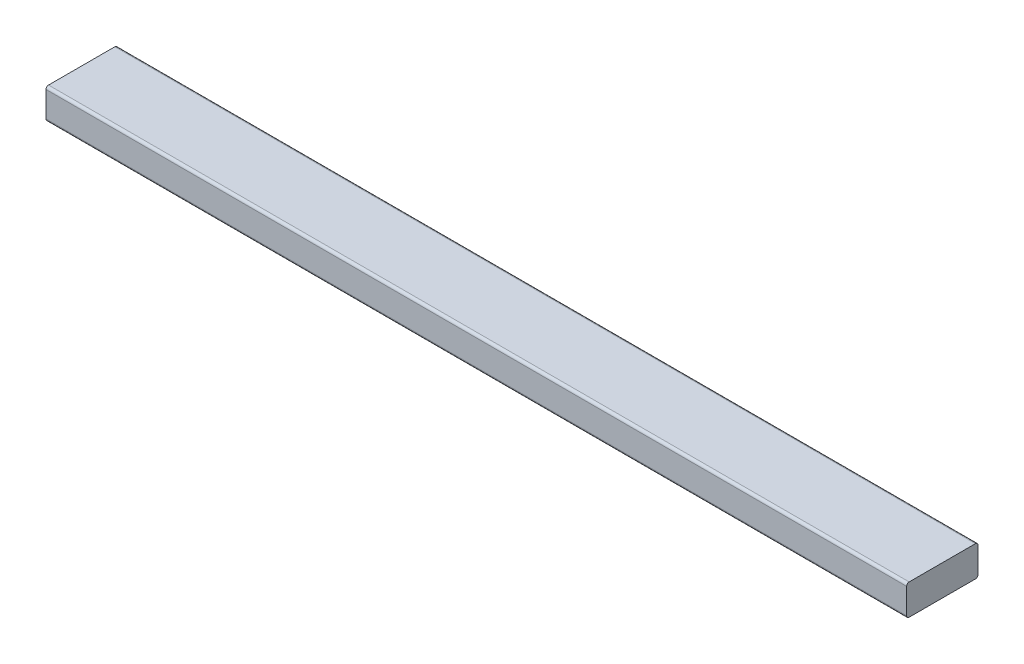
from build123d import *

# Parameters (mm, degrees)
SKETCH1_W           = 1071.5625
SKETCH1_H           = 38.1
BOSS_EXTRUDE1_DEPTH = 88.9
FILLET1_R           = 3.175


with BuildPart() as part:
    # Sketch1 → Boss-Extrude1 (new body)
    with BuildSketch(Plane.XY):
        with Locations((0, 19.05)):
            Rectangle(SKETCH1_W, SKETCH1_H)
    extrude(amount=BOSS_EXTRUDE1_DEPTH)

    # Fillet1
    fillet1_edges = [part.edges().sort_by_distance(p)[0] for p in [
        (0, 38.1, 88.9),
        (0, 38.1, 0),
        (0, 0, 0),
        (0, 0, 88.9),
    ]]
    fillet(fillet1_edges, radius=FILLET1_R)


solid = part.part
